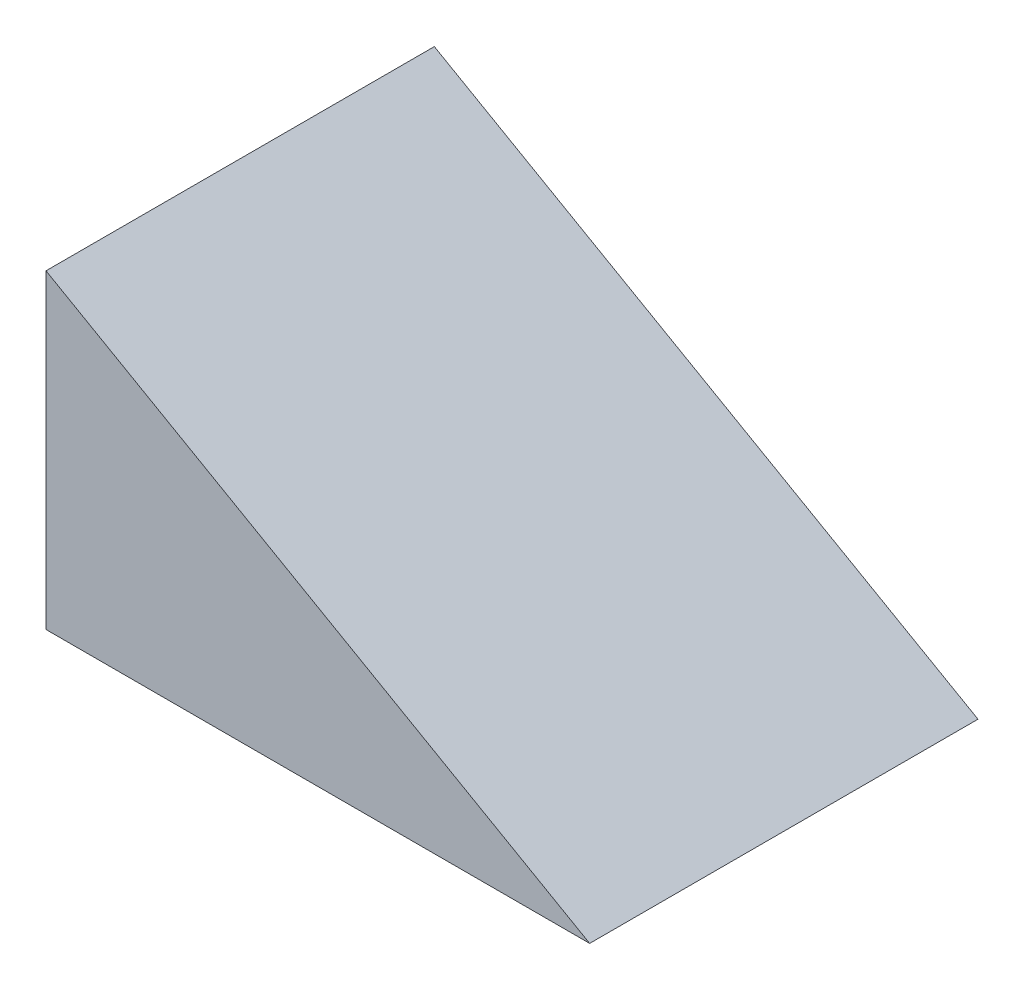
from build123d import *

# Parameters (mm, degrees)
BOSS_EXTRUDE1_DEPTH = 50


with BuildPart() as part:
    # Sketch2 → Boss-Extrude1 (new body)
    with BuildSketch(Plane.XY):
        Polygon((0, 0), (70, 0), (0, 40), align=None)
    extrude(amount=BOSS_EXTRUDE1_DEPTH)


solid = part.part
